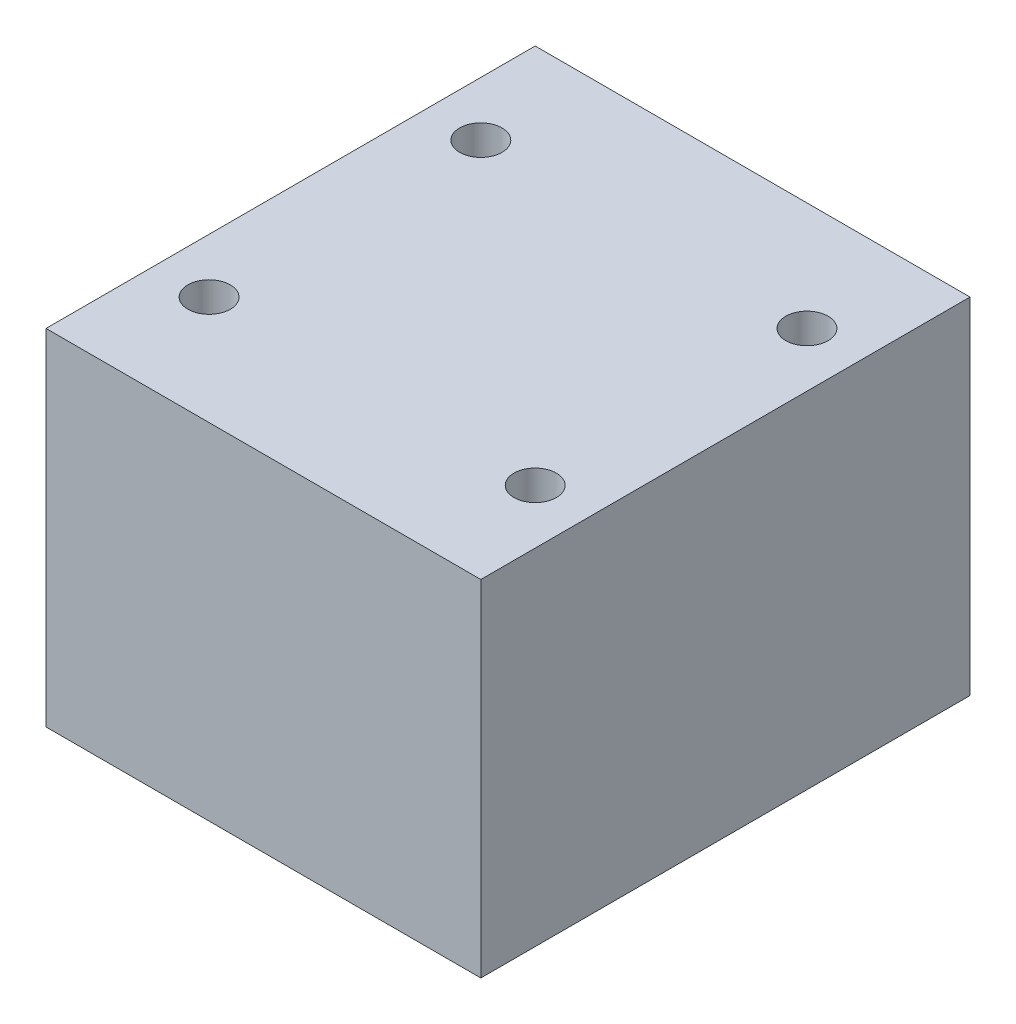
from build123d import *

# Parameters (mm, degrees)
SKETCH1_W           = 40
SKETCH1_H           = 45
SKETCH1_R           = 1.95
BOSS_EXTRUDE1_DEPTH = 31.75


with BuildPart() as part:
    # Sketch1 → Boss-Extrude1 (new body)
    with BuildSketch(Plane(origin=(0, 0, 0), x_dir=(1, 0, 0), z_dir=(0, 1, 0))):
        with Locations((9.133884267, 6.778052775)):
            Rectangle(SKETCH1_W, SKETCH1_H)
        with Locations(Location((-5.866115733, 19.278052775, 0), (0, 0, 270))):
            Circle(SKETCH1_R, mode=Mode.SUBTRACT)
        with Locations(Location((24.133884267, 19.278052775, 0), (0, 0, 270))):
            Circle(SKETCH1_R, mode=Mode.SUBTRACT)
        with Locations(Location((24.133884267, -5.721947225, 0), (0, 0, 270))):
            Circle(SKETCH1_R, mode=Mode.SUBTRACT)
        with Locations(Location((-5.866115733, -5.721947225, 0), (0, 0, 270))):
            Circle(SKETCH1_R, mode=Mode.SUBTRACT)
    extrude(amount=BOSS_EXTRUDE1_DEPTH)


solid = part.part
